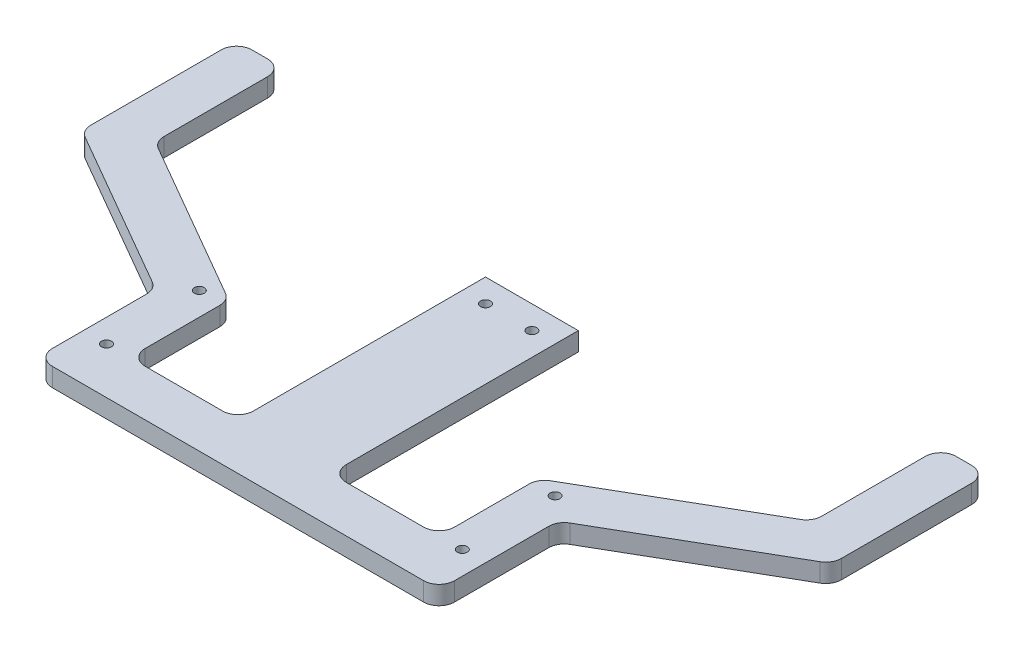
from build123d import *

# Parameters (mm, degrees)
BOSS_EXTRUDE1_DEPTH  = 6
FILLET1_R            = 5
SKETCH2_R            = 1.6
CUT_EXTRUDE1_DEPTH   = 162.089156951
FILLET1_OF_MIRROR1_R = 5


with BuildPart() as part:
    # Sketch1 → Boss-Extrude1 (new body)
    with BuildSketch(Plane(origin=(0, 0, 0), x_dir=(1, 0, 0), z_dir=(0, 1, 0))):
        Polygon((-50, 0), (-50, 32), (-106.291651246, 64.5), (-106.291651246, 105.839745962), (-121.291651246, 105.839745962), (-121.291651246, 55.839745962), (-65, 23.339745962), (-65, -15), (0, -15), (0, 0), (0, 80), (-15, 80), (-15, 0), align=None)
    boss_extrude1 = extrude(amount=BOSS_EXTRUDE1_DEPTH)

    # Fillet1
    fillet1_edges = [part.edges().sort_by_distance(p)[0] for p in [
        (-65, 3, 15),
        (-65, 3, -23.339745962),
        (-121.291651246, 3, -55.839745962),
        (-121.291651246, 3, -105.839745962),
        (-106.291651246, 3, -105.839745962),
        (-106.291651246, 3, -64.5),
        (-50, 3, -32),
        (-50, 3, 0),
        (-15, 3, 0),
    ]]
    fillet(fillet1_edges, radius=FILLET1_R)

    # Sketch2 → Cut-Extrude1 (cut, through all)
    with BuildSketch(Plane(origin=(0, 6, 0), x_dir=(1, 0, 0), z_dir=(0, 1, 0))):
        with Locations(Location((-7.5, 72.5, 0), (0, 0, 270))):
            Circle(SKETCH2_R)
        with Locations(Location((-57.5, 30, 0), (0, 0, 270))):
            Circle(SKETCH2_R)
        with Locations(Location((-57.5, 0, 0), (0, 0, 270))):
            Circle(SKETCH2_R)
    cut_extrude1 = extrude(amount=-CUT_EXTRUDE1_DEPTH, mode=Mode.SUBTRACT)

    # Mirror1: Boss-Extrude1, Cut-Extrude1 across plane
    add(boss_extrude1.mirror(Plane(origin=(0, 0, 0), x_dir=(0, 0, 1), z_dir=(1, 0, 0))))
    add(cut_extrude1.mirror(Plane(origin=(0, 0, 0), x_dir=(0, 0, 1), z_dir=(1, 0, 0))), mode=Mode.SUBTRACT)

    # Fillet1 of Mirror1
    fillet1_of_mirror1_edges = [part.edges().sort_by_distance(p)[0] for p in [
        (65, 3, 15),
        (65, 3, -23.339745962),
        (121.291651246, 3, -55.839745962),
        (121.291651246, 3, -105.839745962),
        (106.291651246, 3, -105.839745962),
        (106.291651246, 3, -64.5),
        (50, 3, -32),
        (50, 3, 0),
        (15, 3, 0),
    ]]
    fillet(fillet1_of_mirror1_edges, radius=FILLET1_OF_MIRROR1_R)


solid = part.part
